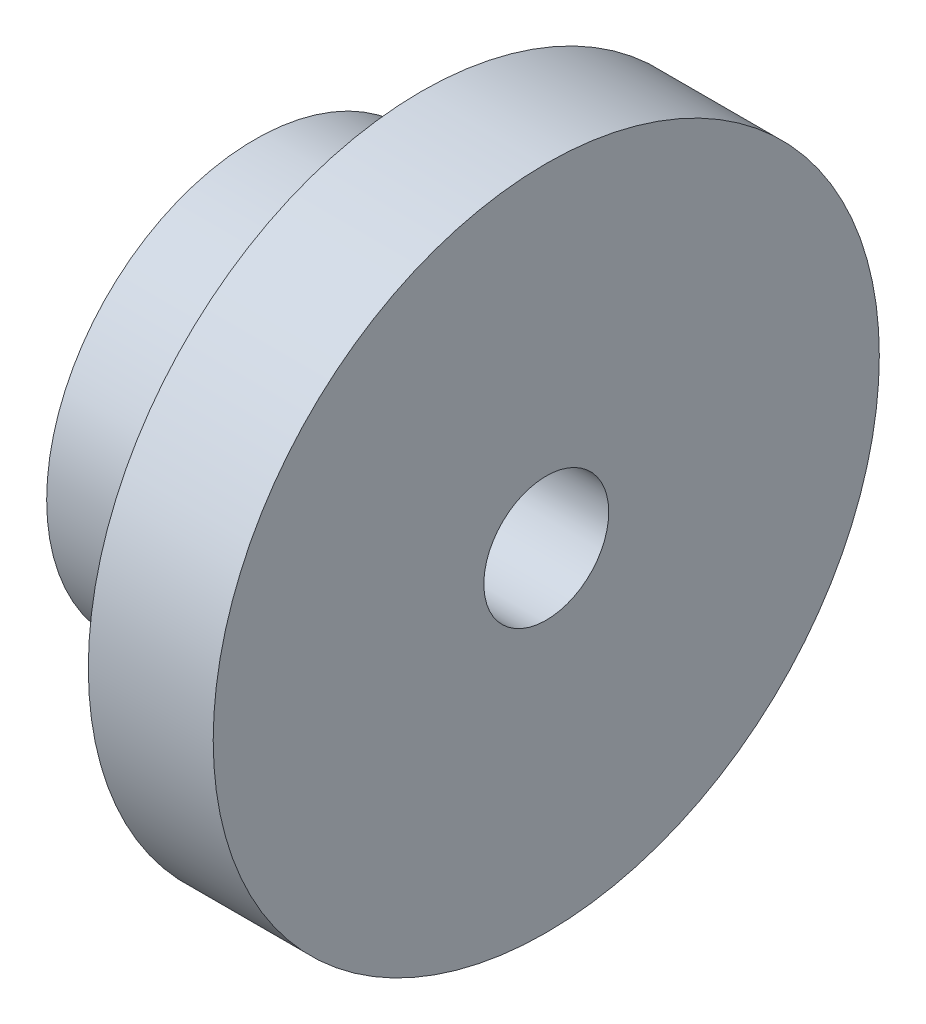
from build123d import *

# Parameters (mm, degrees)
SKETCH1_R             = 12.7
BOSS_EXTRUDE1_DEPTH   = 4.7625
SKETCH2_R             = 7.9375
BOSS_EXTRUDE2_DEPTH   = 6.35
F_4_CLEARANCE_HOLE1_D = 4.7625


with BuildPart() as part:
    # Sketch1 → Boss-Extrude1 (new body)
    with BuildSketch(Plane(origin=(0, 0, 0), x_dir=(0, 0, -1), z_dir=(1, 0, 0))):
        with Locations(Location((0, 0, 0), (0, 0, 180))):
            Circle(SKETCH1_R)
    extrude(amount=BOSS_EXTRUDE1_DEPTH)

    # Sketch2 → Boss-Extrude2 (add)
    with BuildSketch(Plane.ZY):
        with Locations(Location((0, 0, 0), (0, 0, 180))):
            Circle(SKETCH2_R)
    extrude(amount=BOSS_EXTRUDE2_DEPTH)

    # #4 Clearance Hole1 (through all)
    with Locations(Plane(origin=(4.7625, 0, 0), x_dir=(0, 0, -1), z_dir=(1, 0, 0))):
        with Locations((0, 0)):
            Hole(F_4_CLEARANCE_HOLE1_D / 2)


solid = part.part
